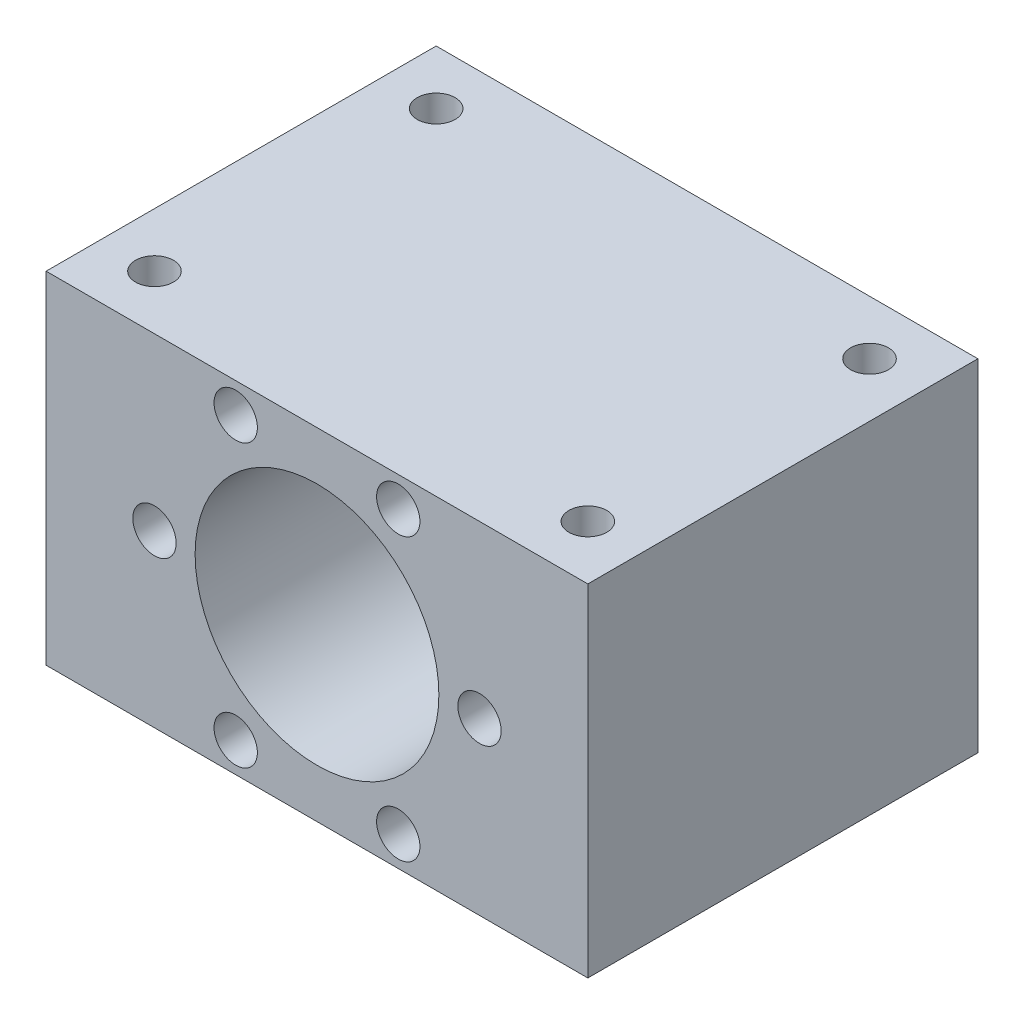
from build123d import *

# Parameters (mm, degrees)
CROQUIS1_W              = 50
CROQUIS1_H              = 31.5
CROQUIS1_R              = 11.25
SALIENTE_EXTRUIR1_DEPTH = 36
CROQUIS2_R              = 1.75
CORTAR_EXTRUIR1_DEPTH   = 10
CROQUIS3_R              = 2
CORTAR_EXTRUIR2_DEPTH   = 18
MATRIZC1_COUNT          = 6


with BuildPart() as part:
    # Croquis1 → Saliente-Extruir1 (new body)
    with BuildSketch(Plane.XY):
        Rectangle(CROQUIS1_W, CROQUIS1_H)
        Circle(CROQUIS1_R, mode=Mode.SUBTRACT)
    extrude(amount=SALIENTE_EXTRUIR1_DEPTH)

    # Croquis2 → Cortar-Extruir1 (cut)
    with BuildSketch(Plane(origin=(0, 15.75, 0), x_dir=(1, 0, 0), z_dir=(0, 1, 0))):
        with Locations(Location((-20, -5, 0), (0, 0, 270))):
            Circle(CROQUIS2_R)
        with Locations(Location((20, -5, 0), (0, 0, 270))):
            Circle(CROQUIS2_R)
        with Locations(Location((20, -31, 0), (0, 0, 270))):
            Circle(CROQUIS2_R)
        with Locations(Location((-20, -31, 0), (0, 0, 270))):
            Circle(CROQUIS2_R)
    extrude(amount=-CORTAR_EXTRUIR1_DEPTH, mode=Mode.SUBTRACT)

    # Croquis3 → Cortar-Extruir2 (cut)
    with BuildSketch(Plane.XY.offset(36)):
        with Locations((-15, 0)):
            Circle(CROQUIS3_R)
    cortar_extruir2 = extrude(amount=-CORTAR_EXTRUIR2_DEPTH, mode=Mode.SUBTRACT)

    # MatrizC1: Cortar-Extruir2 ×6 about axis
    matrizc1_axis = Axis((0, 0, 0), (0, 0, 1))
    for i in range(1, MATRIZC1_COUNT):
        add(cortar_extruir2.rotate(matrizc1_axis, i * 360 / MATRIZC1_COUNT), mode=Mode.SUBTRACT)


solid = part.part
